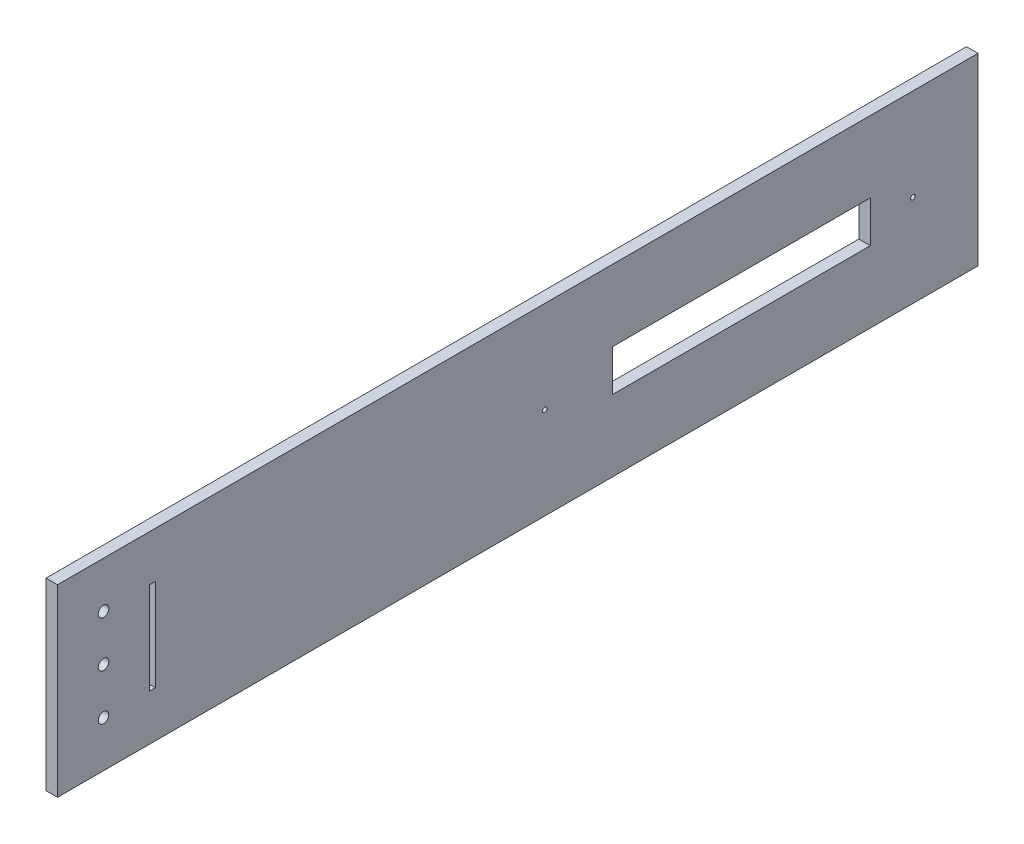
from build123d import *

# Parameters (mm, degrees)
SKETCH1_W           = 254
SKETCH1_H           = 50.8
SKETCH1_R           = 0.635
SKETCH1_R_2         = 1.4605
SKETCH1_W_2         = 71.154066826
SKETCH1_H_2         = 11.43
SKETCH1_W_3         = 1.5875
SKETCH1_H_3         = 25.4
BOSS_EXTRUDE1_DEPTH = 3.175


with BuildPart() as part:
    # Sketch1 → Boss-Extrude1 (new body)
    with BuildSketch(Plane(origin=(0, 0, 0), x_dir=(0, 0, -1), z_dir=(1, 0, 0))):
        with Locations((-127, 0)):
            Rectangle(SKETCH1_W, SKETCH1_H)
        with Locations((-17.9578, 0)):
            Circle(SKETCH1_R, mode=Mode.SUBTRACT)
        with Locations((-119.5578, 0)):
            Circle(SKETCH1_R, mode=Mode.SUBTRACT)
        with Locations((-241.3, 0)):
            Circle(SKETCH1_R_2, mode=Mode.SUBTRACT)
        with Locations((-241.3, 12.7)):
            Circle(SKETCH1_R_2, mode=Mode.SUBTRACT)
        with Locations((-241.3, -12.7)):
            Circle(SKETCH1_R_2, mode=Mode.SUBTRACT)
        with Locations((-65.295033413, 0)):
            Rectangle(SKETCH1_W_2, SKETCH1_H_2, mode=Mode.SUBTRACT)
        with Locations((-227.80625, 0)):
            Rectangle(SKETCH1_W_3, SKETCH1_H_3, mode=Mode.SUBTRACT)
    extrude(amount=-BOSS_EXTRUDE1_DEPTH)


solid = part.part
